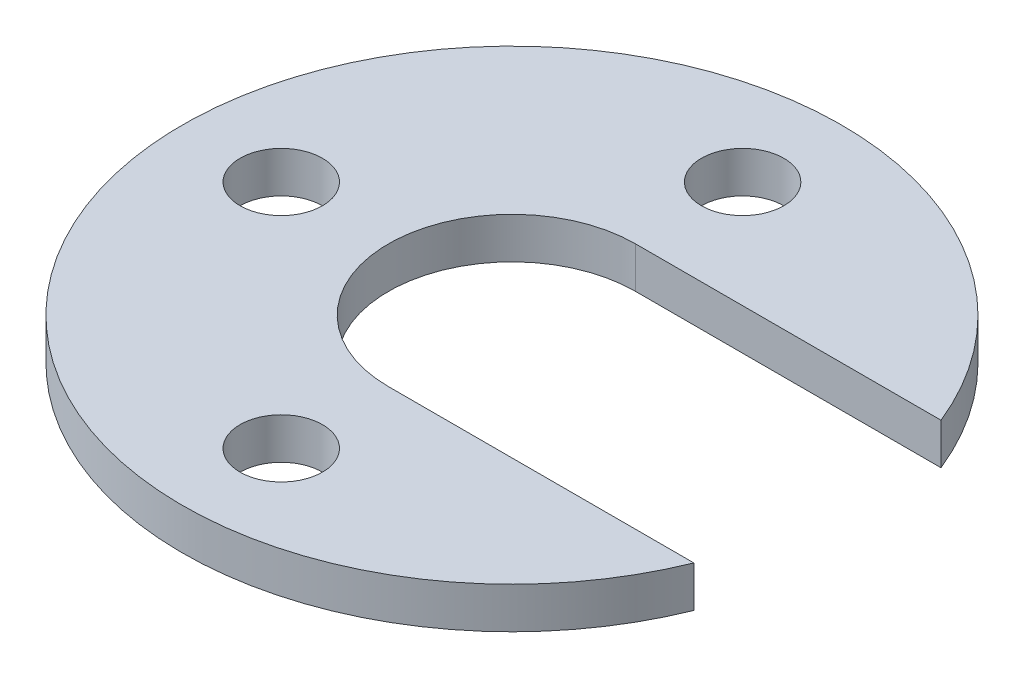
from build123d import *

# Parameters (mm, degrees)
SKETCH1_R           = 5
BOSS_EXTRUDE1_DEPTH = 5


with BuildPart() as part:
    # Sketch1 → Boss-Extrude1 (new body)
    with BuildSketch(Plane(origin=(0, 0, 0), x_dir=(1, 0, 0), z_dir=(0, 1, 0))):
        with BuildLine():
            Line((0, 15), (37.080992435, 15))
            ThreePointArc((37.080992435, 15), (-40, 0), (37.080992435, -15))
            Line((37.080992435, -15), (0, -15))
            ThreePointArc((0, -15), (-15, 0), (0, 15))
        make_face()
        with Locations(Location((-28, 0, 0), (0, 0, 270))):
            Circle(SKETCH1_R, mode=Mode.SUBTRACT)
        with Locations(Location((0, 28, 0), (0, 0, 270))):
            Circle(SKETCH1_R, mode=Mode.SUBTRACT)
        with Locations(Location((0, -28, 0), (0, 0, 270))):
            Circle(SKETCH1_R, mode=Mode.SUBTRACT)
    extrude(amount=BOSS_EXTRUDE1_DEPTH)


solid = part.part
